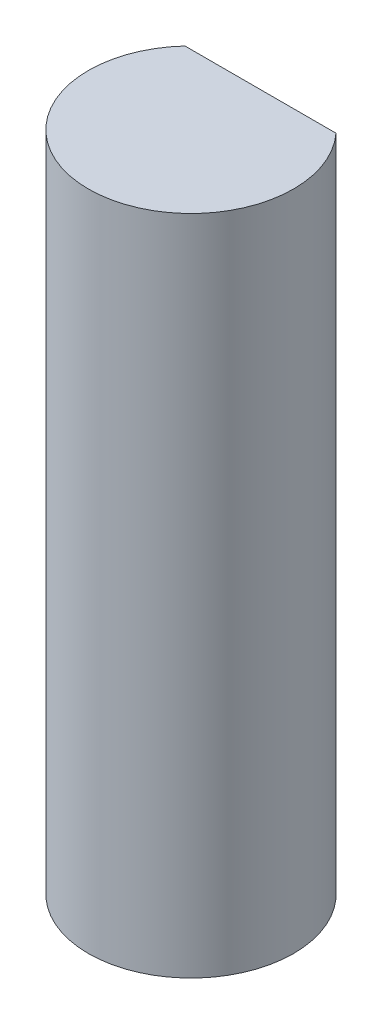
from build123d import *

# Parameters (mm, degrees)
SKETCH_1_R          = 1.55
EXTRUDE_1_DEPTH     = 10
CUT_EXTRUDE_START   = -9
CUT_EXTRUDE_1_DEPTH = 9


with BuildPart() as part:
    # Эскиз1 → Бобышка-Вытянуть1 (new body)
    with BuildSketch(Plane(origin=(0, 0, 0), x_dir=(1, 0, 0), z_dir=(0, 1, 0))):
        with Locations(Location((0, 0, 0), (0, 0, 270))):
            Circle(SKETCH_1_R)
    extrude(amount=EXTRUDE_1_DEPTH)

    # Эскиз3 → Вырез-Вытянуть1 (cut)
    with BuildSketch(Plane(origin=(0, 10, 0), x_dir=(1, 0, 0), z_dir=(0, 1, 0)).offset(CUT_EXTRUDE_START)):
        with BuildLine():
            Line((-1.140175425, 1.05), (1.140175425, 1.05))
            ThreePointArc((1.140175425, 1.05), (0, 1.55), (-1.140175425, 1.05))
        make_face()
    extrude(amount=CUT_EXTRUDE_1_DEPTH, mode=Mode.SUBTRACT)


solid = part.part
